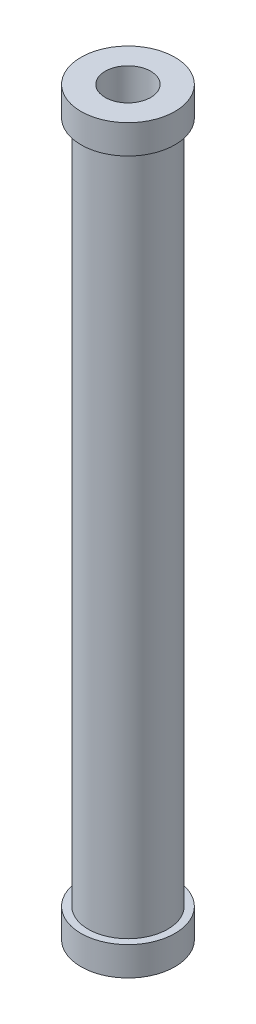
from build123d import *

# Parameters (mm, degrees)
SKETCH1_R           = 2.75
SKETCH1_R_2         = 1.575
BOSS_EXTRUDE1_DEPTH = 51.25
SKETCH1_3_R         = 3.25
SKETCH1_3_R_2       = 2.75
BOSS_EXTRUDE2_DEPTH = 2
BOSS_EXTRUDE3_START = 49.25
SKETCH1_4_R         = 3.25
SKETCH1_4_R_2       = 2.75
BOSS_EXTRUDE3_DEPTH = 2


with BuildPart() as part:
    # Sketch1 → Boss-Extrude1 (new body)
    with BuildSketch(Plane(origin=(0, 0, 0), x_dir=(1, 0, 0), z_dir=(0, 1, 0))):
        Circle(SKETCH1_R)
        Circle(SKETCH1_R_2, mode=Mode.SUBTRACT)
    extrude(amount=BOSS_EXTRUDE1_DEPTH)

    # Sketch1<3> → Boss-Extrude2 (add)
    with BuildSketch(Plane(origin=(0, 0, 0), x_dir=(1, 0, 0), z_dir=(0, 1, 0))):
        Circle(SKETCH1_3_R)
        Circle(SKETCH1_3_R_2, mode=Mode.SUBTRACT)
    extrude(amount=BOSS_EXTRUDE2_DEPTH)

    # Sketch1<4> → Boss-Extrude3 (add)
    with BuildSketch(Plane(origin=(0, 0, 0), x_dir=(1, 0, 0), z_dir=(0, 1, 0)).offset(BOSS_EXTRUDE3_START)):
        Circle(SKETCH1_4_R)
        Circle(SKETCH1_4_R_2, mode=Mode.SUBTRACT)
    extrude(amount=BOSS_EXTRUDE3_DEPTH)


solid = part.part
